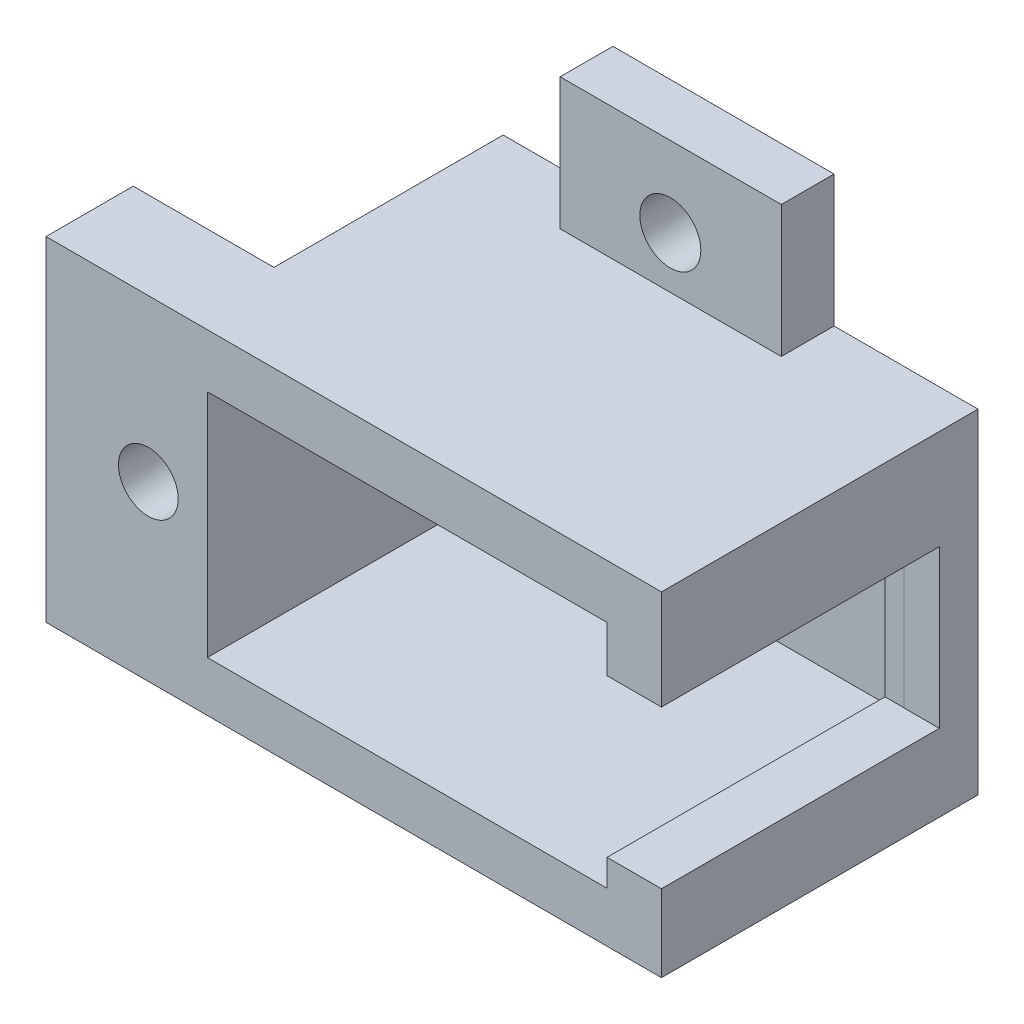
from build123d import *

# Parameters (mm, degrees)
SKETCH1_W            = 2.5
SKETCH1_H            = 1.5
BOSS_EXTRUDE1_DEPTH  = 1.8
SKETCH2_W            = 2.272709172
SKETCH2_H            = 1.309335963
CUT_EXTRUDE1_DEPTH   = 1.7
SKETCH3_W            = 0.001965442
SKETCH3_H            = 0.00266433
SKETCH3_W_2          = 1.44909182
SKETCH3_H_2          = 0.895759853
CUT_EXTRUDE2_DEPTH   = 1.8
SCALE1_SCALE         = 10
SKETCH6_W            = 3.399300392
SKETCH6_H            = 8.946780682
CUT_EXTRUDE4_DEPTH   = 10
SKETCH12_W           = 4.961896536
SKETCH12_H           = 15
BOSS_EXTRUDE5_DEPTH  = 8
SKETCH13_R           = 1.698754484
CUT_EXTRUDE6_DEPTH   = 34
SKETCH22_W           = 12.579678002
SKETCH22_H           = 9.485518979
BOSS_EXTRUDE10_DEPTH = 3
SKETCH25_R           = 1.733474482
CUT_EXTRUDE7_DEPTH   = 36
SKETCH26_W           = 6.246850144
SKETCH26_H           = 18
BOSS_EXTRUDE11_DEPTH = 2
SKETCH27_W           = 6.184798315
SKETCH27_H           = 18
BOSS_EXTRUDE12_DEPTH = 2
SKETCH28_W           = 12.580266047
SKETCH28_H           = 15
BOSS_EXTRUDE13_DEPTH = 2
SKETCH29_W           = 6.217055849
SKETCH29_H           = 18
BOSS_EXTRUDE14_DEPTH = 2
SKETCH30_W           = 6.149592849
SKETCH30_H           = 18
BOSS_EXTRUDE15_DEPTH = 2
SKETCH31_W           = 12.597557791
SKETCH31_H           = 15
BOSS_EXTRUDE16_DEPTH = 2
SKETCH32_W           = 8
SKETCH32_H           = 4.961896536
BOSS_EXTRUDE17_DEPTH = 2
SKETCH33_W           = 0.035793511
SKETCH33_H           = 18
BOSS_EXTRUDE18_DEPTH = 2
SKETCH34_W           = 8
SKETCH34_H           = 4.961896536
BOSS_EXTRUDE19_DEPTH = 2
SKETCH36_W           = 18
SKETCH36_H           = 4.317479632
BOSS_EXTRUDE20_DEPTH = 2
SKETCH37_W           = 18
SKETCH37_H           = 5.630697462
BOSS_EXTRUDE21_DEPTH = 2
SKETCH38_W           = 2.199407661
SKETCH38_H           = 9.051822906
BOSS_EXTRUDE22_DEPTH = 2
SKETCH39_W           = 15.800592339
SKETCH39_H           = 0.042851216
BOSS_EXTRUDE23_DEPTH = 2
SKETCH40_W           = 15.800592339
SKETCH40_H           = 0.062191008
BOSS_EXTRUDE24_DEPTH = 2


with BuildPart() as part:
    # Sketch1 → Boss-Extrude1 (new body)
    with BuildSketch(Plane.XY):
        with Locations((0.15674366, 0.085055811)):
            Rectangle(SKETCH1_W, SKETCH1_H)
    extrude(amount=BOSS_EXTRUDE1_DEPTH)

    # Sketch2 → Cut-Extrude1 (cut)
    with BuildSketch(Plane.XY.offset(1.8)):
        with Locations((0.160861454, 0.075181403)):
            Rectangle(SKETCH2_W, SKETCH2_H)
    extrude(amount=-CUT_EXTRUDE1_DEPTH, mode=Mode.SUBTRACT)

    # Sketch3 → Cut-Extrude2 (cut)
    with BuildSketch(Plane(origin=(1.40674366, 0, 0), x_dir=(0, 0, -1), z_dir=(1, 0, 0))):
        with Locations((-0.29122496, -0.460339146)):
            Rectangle(SKETCH3_W, SKETCH3_H)
        with Locations((-0.943862586, 0.020902802)):
            Rectangle(SKETCH3_W_2, SKETCH3_H_2)
    extrude(amount=-CUT_EXTRUDE2_DEPTH, mode=Mode.SUBTRACT)


with BuildPart() as part_1:
    # Scale1: scaled about (0.033599126, 0.123190455, 0.732690955)
    add(part.part.scale(SCALE1_SCALE).moved(Location((-0.302392134, -1.108714095, -6.594218595))))

    # Sketch6 → Cut-Extrude4 (cut)
    with BuildSketch(Plane(origin=(13.765044467, 0, 0), x_dir=(0, 0, -1), z_dir=(1, 0, 0))):
        with Locations((-11.016576897, -0.905094997)):
            Rectangle(SKETCH6_W, SKETCH6_H)
    extrude(amount=-CUT_EXTRUDE4_DEPTH, mode=Mode.SUBTRACT)

    # Sketch12 → Boss-Extrude5 (add)
    with BuildSketch(Plane.ZY.offset(11.234955533)):
        with Locations((8.924833137, -0.258155978)):
            Rectangle(SKETCH12_W, SKETCH12_H)
    extrude(amount=BOSS_EXTRUDE5_DEPTH)

    # Sketch13 → Cut-Extrude6 (cut)
    with BuildSketch(Plane.XY.offset(11.405781405)):
        with Locations((-13.415722705, 0.071814751)):
            Circle(SKETCH13_R)
    extrude(amount=-CUT_EXTRUDE6_DEPTH, mode=Mode.SUBTRACT)

    # Sketch22 → Boss-Extrude10 (add)
    with BuildSketch(Plane(origin=(0, 0, -6.594218595), x_dir=(-1, 0, 0), z_dir=(0, 0, -1))):
        with Locations((-1.289819106, 11.984603512)):
            Rectangle(SKETCH22_W, SKETCH22_H)
        with Locations((-1.289819106, -12.500915468)):
            Rectangle(SKETCH22_W, SKETCH22_H)
    extrude(amount=-BOSS_EXTRUDE10_DEPTH)

    # Sketch25 → Cut-Extrude7 (cut)
    with BuildSketch(Plane.XY.offset(-3.594218595)):
        with Locations((1.268574204, 12.179653892)):
            Circle(SKETCH25_R)
        with Locations((1.268574204, -12.893454026)):
            Circle(SKETCH25_R)
    extrude(amount=-CUT_EXTRUDE7_DEPTH, mode=Mode.SUBTRACT)

    # Sketch26 → Boss-Extrude11 (add)
    with BuildSketch(Plane(origin=(0, 7.241844022, 0), x_dir=(1, 0, 0), z_dir=(0, 1, 0))):
        with Locations((-8.111530461, -2.405781405)):
            Rectangle(SKETCH26_W, SKETCH26_H)
    extrude(amount=BOSS_EXTRUDE11_DEPTH)

    # Sketch27 → Boss-Extrude12 (add)
    with BuildSketch(Plane(origin=(0, 7.241844022, 0), x_dir=(1, 0, 0), z_dir=(0, 1, 0))):
        with Locations((10.67264531, -2.405781405)):
            Rectangle(SKETCH27_W, SKETCH27_H)
    extrude(amount=BOSS_EXTRUDE12_DEPTH)

    # Sketch28 → Boss-Extrude13 (add)
    with BuildSketch(Plane(origin=(0, 7.241844022, 0), x_dir=(1, 0, 0), z_dir=(0, 1, 0))):
        with Locations((1.290113129, -3.905781405)):
            Rectangle(SKETCH28_W, SKETCH28_H)
    extrude(amount=BOSS_EXTRUDE13_DEPTH)

    # Sketch29 → Boss-Extrude14 (add)
    with BuildSketch(Plane(origin=(0, -7.758155978, 0), x_dir=(-1, 0, 0), z_dir=(0, -1, 0))):
        with Locations((8.126427609, -2.405781405)):
            Rectangle(SKETCH29_W, SKETCH29_H)
    extrude(amount=BOSS_EXTRUDE14_DEPTH)

    # Sketch30 → Boss-Extrude15 (add)
    with BuildSketch(Plane(origin=(0, -7.758155978, 0), x_dir=(-1, 0, 0), z_dir=(0, -1, 0))):
        with Locations((-10.690248043, -2.405781405)):
            Rectangle(SKETCH30_W, SKETCH30_H)
    extrude(amount=BOSS_EXTRUDE15_DEPTH)

    # Sketch31 → Boss-Extrude16 (add)
    with BuildSketch(Plane.XZ.offset(7.758155978)):
        with Locations((1.280879211, 3.905781405)):
            Rectangle(SKETCH31_W, SKETCH31_H)
    extrude(amount=BOSS_EXTRUDE16_DEPTH)

    # Sketch32 → Boss-Extrude17 (add)
    with BuildSketch(Plane(origin=(0, 7.241844022, 0), x_dir=(1, 0, 0), z_dir=(0, 1, 0))):
        with Locations((-15.234955533, -8.924833137)):
            Rectangle(SKETCH32_W, SKETCH32_H)
    extrude(amount=BOSS_EXTRUDE17_DEPTH)

    # Sketch33 → Boss-Extrude18 (add)
    with BuildSketch(Plane(origin=(0, -7.758155978, 0), x_dir=(-1, 0, 0), z_dir=(0, -1, 0))):
        with Locations((-7.597554863, -2.405781405)):
            Rectangle(SKETCH33_W, SKETCH33_H)
    extrude(amount=BOSS_EXTRUDE18_DEPTH)

    # Sketch34 → Boss-Extrude19 (add)
    with BuildSketch(Plane.XZ.offset(7.758155978)):
        with Locations((-15.234955533, 8.924833137)):
            Rectangle(SKETCH34_W, SKETCH34_H)
    extrude(amount=BOSS_EXTRUDE19_DEPTH)

    # Sketch36 → Boss-Extrude20 (add)
    with BuildSketch(Plane(origin=(13.765044467, 0, 0), x_dir=(0, 0, -1), z_dir=(1, 0, 0))):
        with Locations((-2.405781405, -7.599416162)):
            Rectangle(SKETCH36_W, SKETCH36_H)
    extrude(amount=BOSS_EXTRUDE20_DEPTH)

    # Sketch37 → Boss-Extrude21 (add)
    with BuildSketch(Plane(origin=(13.765044467, 0, 0), x_dir=(0, 0, -1), z_dir=(1, 0, 0))):
        with Locations((-2.405781405, 6.426495291)):
            Rectangle(SKETCH37_W, SKETCH37_H)
    extrude(amount=BOSS_EXTRUDE21_DEPTH)

    # Sketch38 → Boss-Extrude22 (add)
    with BuildSketch(Plane(origin=(13.765044467, 0, 0), x_dir=(0, 0, -1), z_dir=(1, 0, 0))):
        with Locations((5.494514764, -0.914764893)):
            Rectangle(SKETCH38_W, SKETCH38_H)
    extrude(amount=BOSS_EXTRUDE22_DEPTH)

    # Sketch39 → Boss-Extrude23 (add)
    with BuildSketch(Plane(origin=(13.765044467, 0, 0), x_dir=(0, 0, -1), z_dir=(1, 0, 0))):
        with Locations((-3.505485236, 3.589720952)):
            Rectangle(SKETCH39_W, SKETCH39_H)
    extrude(amount=BOSS_EXTRUDE23_DEPTH)

    # Sketch40 → Boss-Extrude24 (add)
    with BuildSketch(Plane(origin=(13.765044467, 0, 0), x_dir=(0, 0, -1), z_dir=(1, 0, 0))):
        with Locations((-3.505485236, -5.409580842)):
            Rectangle(SKETCH40_W, SKETCH40_H)
    extrude(amount=BOSS_EXTRUDE24_DEPTH)


solid = part_1.part
